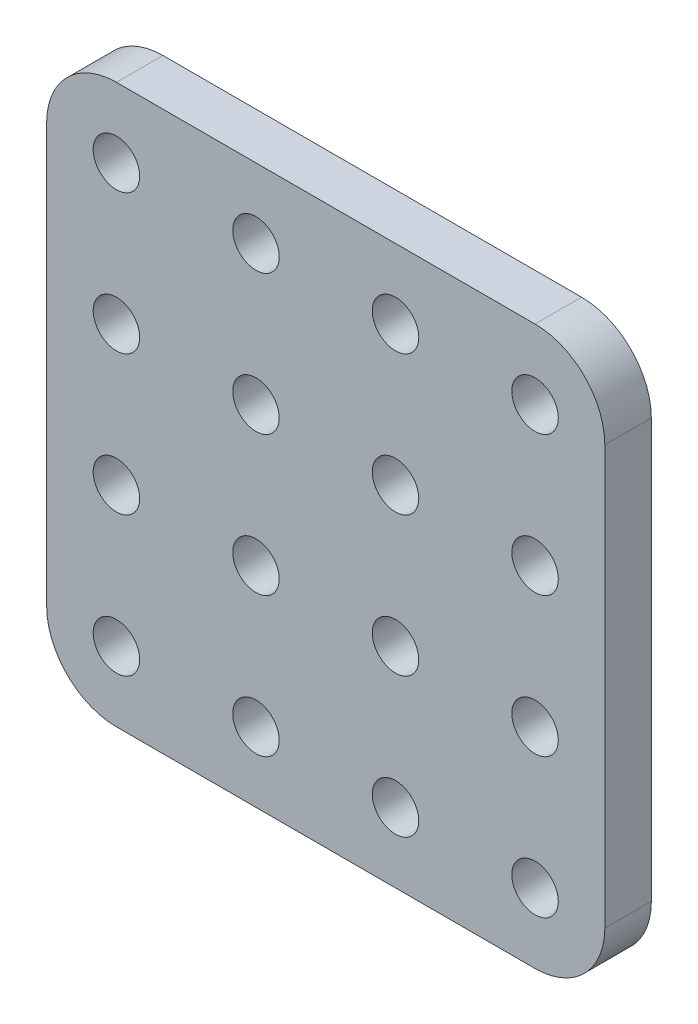
from build123d import *

# Parameters (mm, degrees)
MODEL_R                 = 1.5
SALIENTE_EXTRUIR1_DEPTH = 3


with BuildPart() as part:
    # Model → Saliente-Extruir1 (new body)
    with BuildSketch(Plane.XY):
        with BuildLine():
            Line((-105.943383637, 101.056539338), (-105.943383637, 74.056539338))
            ThreePointArc((-105.943383637, 74.056539338), (-104.625364152, 70.874558823), (-101.443383637, 69.556539338))
            Line((-101.443383637, 69.556539338), (-74.443383637, 69.556539338))
            ThreePointArc((-74.443383637, 69.556539338), (-71.261403122, 70.874558823), (-69.943383637, 74.056539338))
            Line((-69.943383637, 74.056539338), (-69.943383637, 101.056539338))
            ThreePointArc((-69.943383637, 101.056539338), (-71.261403122, 104.238519853), (-74.443383637, 105.556539338))
            Line((-74.443383637, 105.556539338), (-101.443383637, 105.556539338))
            ThreePointArc((-101.443383637, 105.556539338), (-104.625364152, 104.238519853), (-105.943383637, 101.056539338))
        make_face()
        with Locations((-101.443383637, 101.056539338)):
            Circle(MODEL_R, mode=Mode.SUBTRACT)
        with Locations((-92.443383637, 101.056539338)):
            Circle(MODEL_R, mode=Mode.SUBTRACT)
        with Locations((-83.443383637, 101.056539338)):
            Circle(MODEL_R, mode=Mode.SUBTRACT)
        with Locations((-74.443383637, 101.056539338)):
            Circle(MODEL_R, mode=Mode.SUBTRACT)
        with Locations((-101.443383637, 92.056539338)):
            Circle(MODEL_R, mode=Mode.SUBTRACT)
        with Locations((-92.443383637, 92.056539338)):
            Circle(MODEL_R, mode=Mode.SUBTRACT)
        with Locations((-83.443383637, 92.056539338)):
            Circle(MODEL_R, mode=Mode.SUBTRACT)
        with Locations((-74.443383637, 92.056539338)):
            Circle(MODEL_R, mode=Mode.SUBTRACT)
        with Locations((-101.443383637, 83.056539338)):
            Circle(MODEL_R, mode=Mode.SUBTRACT)
        with Locations((-92.443383637, 83.056539338)):
            Circle(MODEL_R, mode=Mode.SUBTRACT)
        with Locations((-83.443383637, 83.056539338)):
            Circle(MODEL_R, mode=Mode.SUBTRACT)
        with Locations((-74.443383637, 83.056539338)):
            Circle(MODEL_R, mode=Mode.SUBTRACT)
        with Locations((-101.443383637, 74.056539338)):
            Circle(MODEL_R, mode=Mode.SUBTRACT)
        with Locations((-92.443383637, 74.056539338)):
            Circle(MODEL_R, mode=Mode.SUBTRACT)
        with Locations((-83.443383637, 74.056539338)):
            Circle(MODEL_R, mode=Mode.SUBTRACT)
        with Locations((-74.443383637, 74.056539338)):
            Circle(MODEL_R, mode=Mode.SUBTRACT)
    extrude(amount=SALIENTE_EXTRUIR1_DEPTH)


solid = part.part
